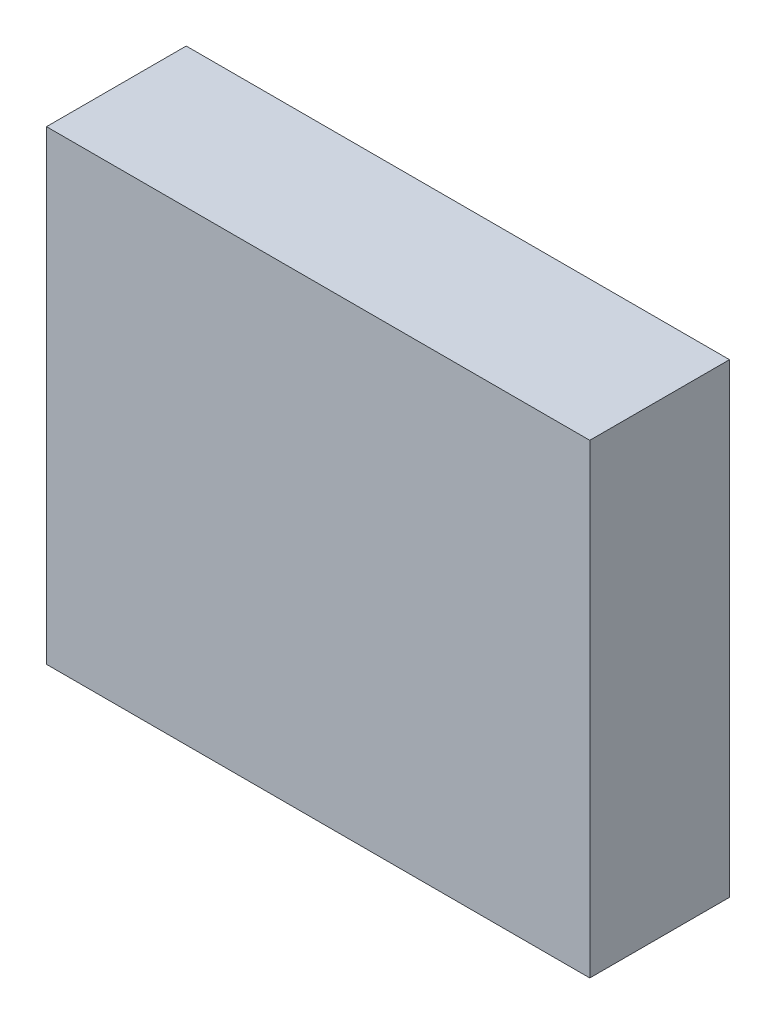
from build123d import *

# Parameters (mm, degrees)
SKETCH_1_W      = 70
SKETCH_1_H      = 60
EXTRUDE_1_DEPTH = 18


with BuildPart() as part:
    # 草图1 → 凸台-拉伸1 (new body)
    with BuildSketch(Plane.XY):
        with Locations((35, -30)):
            Rectangle(SKETCH_1_W, SKETCH_1_H)
    extrude(amount=EXTRUDE_1_DEPTH)


solid = part.part
